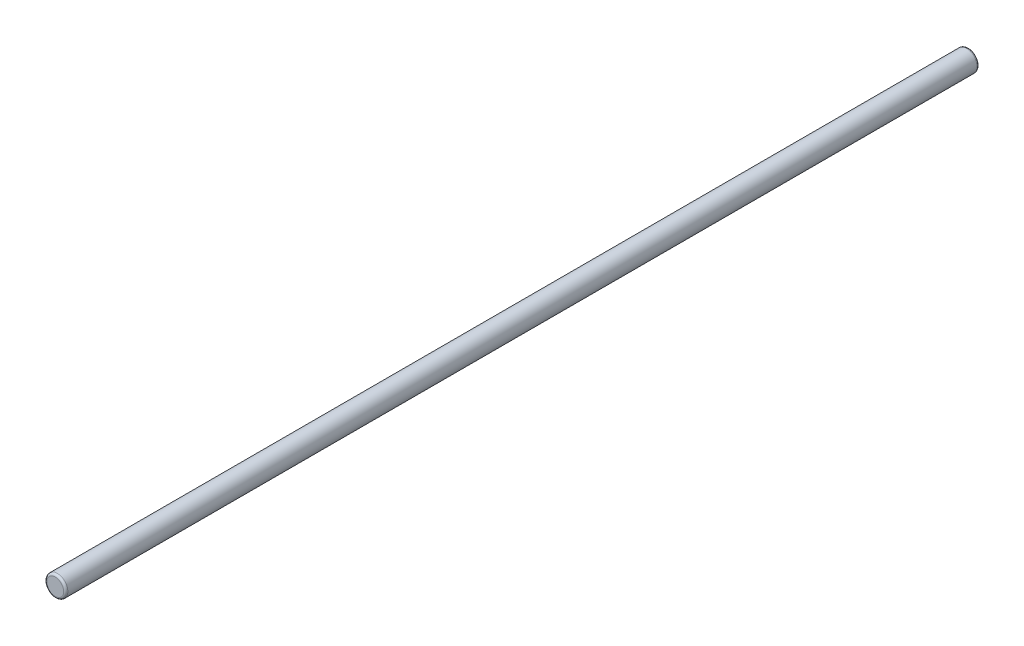
from build123d import *

# Parameters (mm, degrees)
ESQUISSE1_W = 87
ESQUISSE1_H = 1
CONG_1_R    = 0.2
CONG_2_R    = 0.2


with BuildPart() as part:
    # Esquisse1 → Révolution1 (revolve)
    with BuildSketch(Plane(origin=(0, 0, 0), x_dir=(0, 0, -1), z_dir=(1, 0, 0)), mode=Mode.PRIVATE) as r_volution1_sk:
        with Locations((43.5, 0.5)):
            Rectangle(ESQUISSE1_W, ESQUISSE1_H)
    revolve(r_volution1_sk.sketch.rotate(Axis((0, 0, 0), (0, 0, -1)), 90), axis=Axis((0, 0, 0), (0, 0, -1)))

    # Congé1
    cong_1_edges = [part.edges().sort_by_distance(p)[0] for p in [
        (-1, 0, -87),
    ]]
    fillet(cong_1_edges, radius=CONG_1_R)

    # Congé2
    cong_2_edges = [part.edges().sort_by_distance(p)[0] for p in [
        (-1, 0, 0),
    ]]
    fillet(cong_2_edges, radius=CONG_2_R)


solid = part.part
